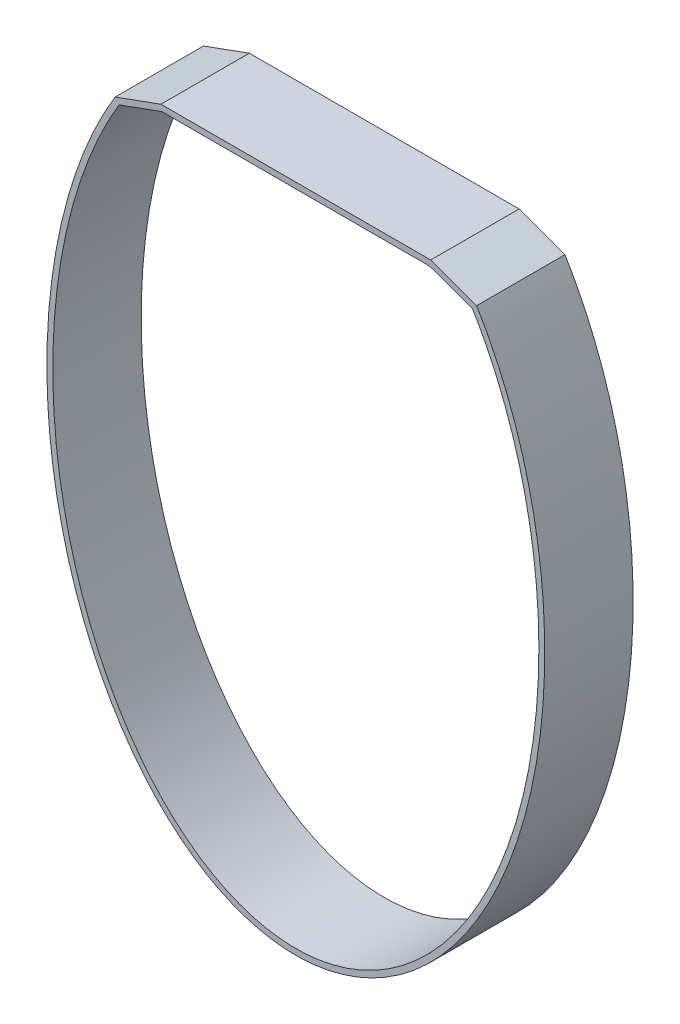
from build123d import *

# Parameters (mm, degrees)
BOSS_EXTRUDE1_DEPTH = 15


with BuildPart() as part:
    # Sketch1 → Boss-Extrude1 (new, symmetric)
    with BuildSketch(Plane.XY):
        with BuildLine():
            Line((45.785258764, 2), (61.345474433, -3.663455381))
            add(Edge.make_bspline(
                [(-61.345474433, -3.663455381), (-62.05458033, -4.825915935), (-63.428208195, -7.162022501), (-66.08065302, -12.015194228), (-69.172315312, -18.343471449), (-72.518346682, -26.337101858), (-76.468150396, -37.46501144), (-80.410472121, -52.150778736), (-83.453817915, -70.647342438), (-84.748527552, -89.631643208), (-84.111066624, -115.067059918), (-78.887863306, -146.090783266), (-66.023186503, -178.998173185), (-47.578275348, -204.850142985), (-24.971107398, -221.457418421), (0, -227.224438209), (24.971107398, -221.457418421), (47.578275348, -204.850142985), (66.023186503, -178.998173185), (78.887863306, -146.090783266), (84.111066624, -115.067059918), (84.748527552, -89.631643208), (83.453817914, -70.647342438), (80.410472121, -52.150778736), (76.468150396, -37.46501144), (72.518346682, -26.337101858), (69.172315312, -18.343471449), (66.08065302, -12.015194228), (63.428208195, -7.162022501), (62.05458033, -4.825915935), (61.345474433, -3.663455381)],
                knots=[0.807969568, 0.807969568, 0.807969568, 0.807969568, 0.844432428, 0.880895289, 0.953821011, 1.026746732, 1.099672453, 1.245523896, 1.391375339, 1.537226782, 1.683078225, 1.974781111, 2.266483996, 2.558186882, 2.849889768, 3.141592654, 3.433295539, 3.724998425, 4.016701311, 4.308404197, 4.600107082, 4.745958525, 4.891809968, 5.037661411, 5.183512854, 5.256438575, 5.329364297, 5.402290018, 5.438752879, 5.475215739, 5.475215739, 5.475215739, 5.475215739], degree=3))
            Line((-61.345474433, -3.663455381), (-45.785258764, 2))
            Line((-45.785258764, 2), (45.785258764, 2))
        make_face()
        with BuildLine():
            Line((-45.4326048, 0), (45.4326048, 0))
            Line((45.4326048, 0), (60, -5.30209828))
            add(Edge.make_bspline(
                [(-60, -5.30209828), (-191.295167614, -223.30209828), (0, -223.30209828), (191.295167614, -223.30209828), (60, -5.30209828)],
                knots=[0.814339942, 0.814339942, 0.814339942, 3.141592654, 3.141592654, 5.468845365, 5.468845365, 5.468845365], degree=2, weights=[1, 0.396012257, 1, 0.396012257, 1]))
            Line((-60, -5.30209828), (-45.4326048, 0))
        make_face(mode=Mode.SUBTRACT)
    extrude(amount=BOSS_EXTRUDE1_DEPTH, both=True)


solid = part.part
